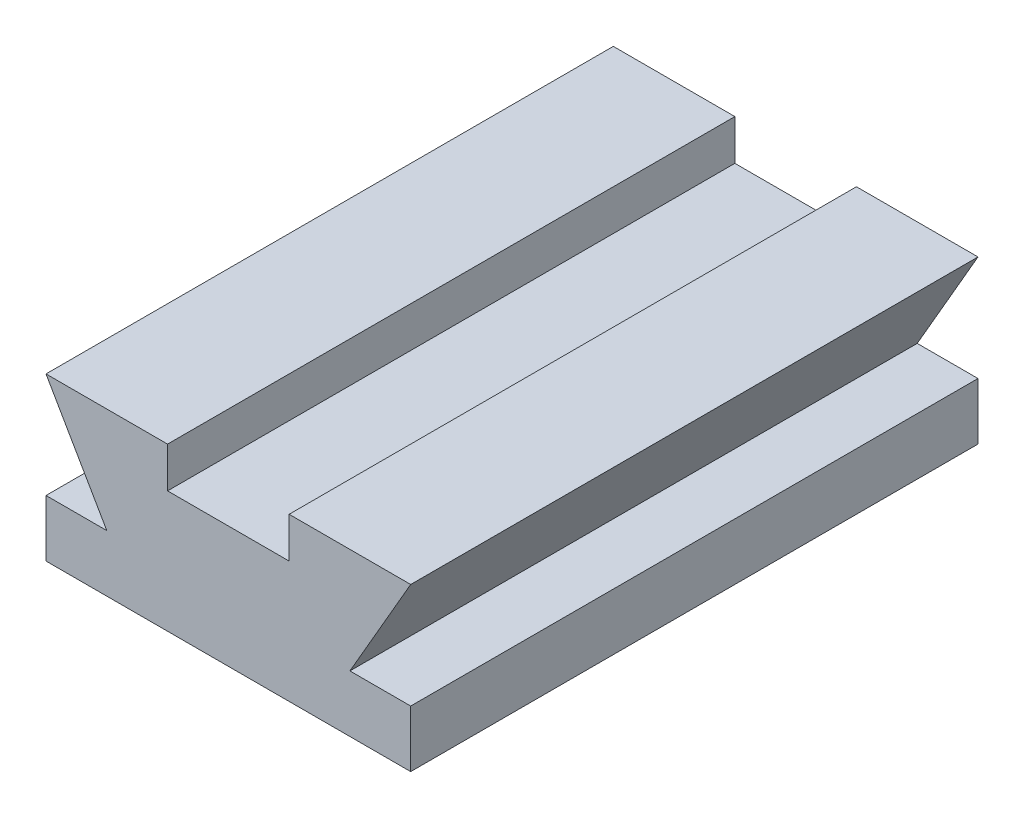
from build123d import *

# Parameters (mm, degrees)
SKETCH1_W           = 4.5
SKETCH1_H           = 7
BOSS_EXTRUDE1_DEPTH = 2
SKETCH2_W           = 1.5
SKETCH2_H           = 7
CUT_EXTRUDE3_DEPTH  = 0.5
CUT_EXTRUDE4_DEPTH  = 9.250795932


with BuildPart() as part:
    # Sketch1 → Boss-Extrude1 (new body)
    with BuildSketch(Plane(origin=(0, 0, 0), x_dir=(1, 0, 0), z_dir=(0, 1, 0))):
        with Locations((1.632735313, 5.351794061)):
            Rectangle(SKETCH1_W, SKETCH1_H)
    extrude(amount=BOSS_EXTRUDE1_DEPTH)

    # Sketch2 → Cut-Extrude3 (cut)
    with BuildSketch(Plane(origin=(0, 2, 0), x_dir=(1, 0, 0), z_dir=(0, 1, 0))):
        with Locations((1.632735313, 5.351794061)):
            Rectangle(SKETCH2_W, SKETCH2_H)
    extrude(amount=-CUT_EXTRUDE3_DEPTH, mode=Mode.SUBTRACT)

    # Sketch3 → Cut-Extrude4 (cut, through all)
    with BuildSketch(Plane(origin=(0, 0, -8.851794061), x_dir=(-1, 0, 0), z_dir=(0, 0, -1))):
        Polygon((0.617264687, 2), (-0.132735313, 0.700961894), (0.617264687, 0.700961894), align=None)
        Polygon((-3.882735313, 2), (-3.132735313, 0.700961894), (-3.882735313, 0.700961894), align=None)
    extrude(amount=-CUT_EXTRUDE4_DEPTH, mode=Mode.SUBTRACT)


solid = part.part
